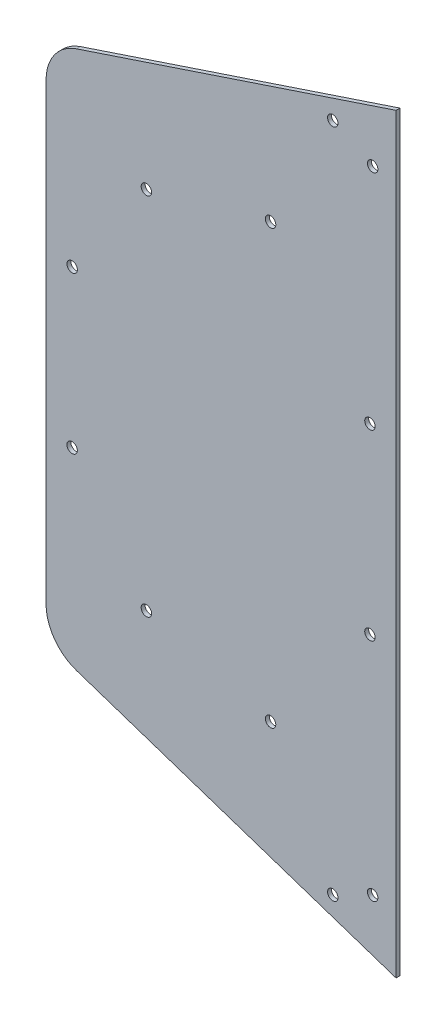
from build123d import *

# Parameters (mm, degrees)
SKETCH1_R           = 4
BOSS_EXTRUDE2_DEPTH = 3


with BuildPart() as part:
    # Sketch1 → Boss-Extrude2 (new body)
    with BuildSketch(Plane(origin=(0, 0, 0), x_dir=(0, 1, 0), z_dir=(0, 0, 1))):
        with BuildLine():
            Line((287.974614048, 15.875), (206.335856543, 260.791272515))
            ThreePointArc((206.335856543, 260.791272515), (193.915277461, 277.683639569), (173.962038997, 284.125))
            Line((173.962038997, 284.125), (0, 284.125))
            Line((0, 284.125), (-60, 284.125))
            Line((-60, 284.125), (-173.962038997, 284.125))
            ThreePointArc((-173.962038997, 284.125), (-193.915277461, 277.683639569), (-206.335856543, 260.791272515))
            Line((-206.335856543, 260.791272515), (-287.974614048, 15.875))
            Line((-287.974614048, 15.875), (-232.974614048, 15.875))
            Line((-232.974614048, 15.875), (287.974614048, 15.875))
        make_face()
        with Locations(Location((-241.845421711, 33.800087766, 0), (0, 0, 270))):
            Circle(SKETCH1_R, mode=Mode.SUBTRACT)
        with Locations(Location((-256.967862764, 64.357743098, 0), (0, 0, 270))):
            Circle(SKETCH1_R, mode=Mode.SUBTRACT)
        with Locations(Location((-70, 35.875, 0), (0, 0, 270))):
            Circle(SKETCH1_R, mode=Mode.SUBTRACT)
        with Locations(Location((-165.911573344, 112.045275134, 0), (0, 0, 270))):
            Circle(SKETCH1_R, mode=Mode.SUBTRACT)
        with Locations(Location((70, 35.875, 0), (0, 0, 270))):
            Circle(SKETCH1_R, mode=Mode.SUBTRACT)
        with Locations(Location((241.845421711, 33.800087766, 0), (0, 0, 270))):
            Circle(SKETCH1_R, mode=Mode.SUBTRACT)
        with Locations(Location((256.967862764, 64.357743098, 0), (0, 0, 270))):
            Circle(SKETCH1_R, mode=Mode.SUBTRACT)
        with Locations(Location((165.911573344, 112.045275134, 0), (0, 0, 270))):
            Circle(SKETCH1_R, mode=Mode.SUBTRACT)
        with Locations(Location((-139.799210518, 207.2176312, 0), (0, 0, 270))):
            Circle(SKETCH1_R, mode=Mode.SUBTRACT)
        with Locations(Location((-60, 264.125, 0), (0, 0, 270))):
            Circle(SKETCH1_R, mode=Mode.SUBTRACT)
        with Locations(Location((139.799210518, 207.2176312, 0), (0, 0, 270))):
            Circle(SKETCH1_R, mode=Mode.SUBTRACT)
        with Locations(Location((60, 264.125, 0), (0, 0, 270))):
            Circle(SKETCH1_R, mode=Mode.SUBTRACT)
    extrude(amount=BOSS_EXTRUDE2_DEPTH)


solid = part.part
